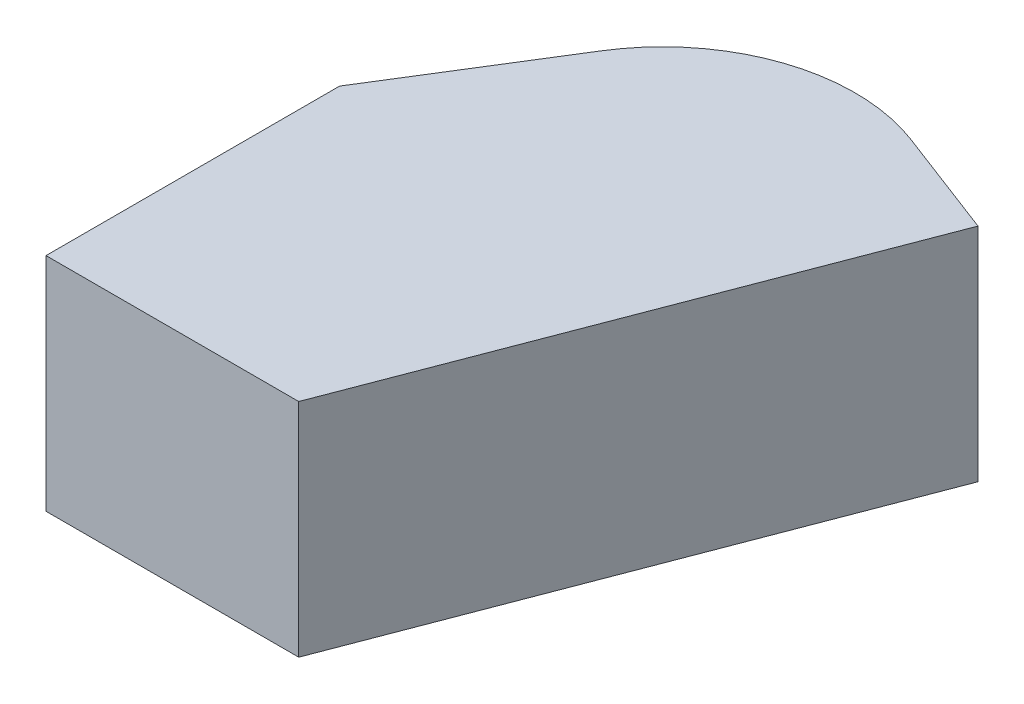
from build123d import *

# Parameters (mm, degrees)
BOSS_EXTRUDE1_DEPTH = 58.42


with BuildPart() as part:
    # Sketch1 → Boss-Extrude1 (new body)
    with BuildSketch(Plane(origin=(0, 0, 0), x_dir=(1, 0, 0), z_dir=(0, 1, 0))):
        with BuildLine():
            Line((-66.673768512, 0), (-40.275724105, 42.472101149))
            ThreePointArc((-40.275724105, 42.472101149), (-13.350388976, 63.796602097), (20.98970616, 63.114049105))
            Line((20.98970616, 63.114049105), (49.511648498, 52.224068087))
            Line((49.511648498, 52.224068087), (0, -77.45185891))
            Line((0, -77.45185891), (-66.673768512, -77.45185891))
            Line((-66.673768512, -77.45185891), (-66.673768512, 0))
        make_face()
    extrude(amount=BOSS_EXTRUDE1_DEPTH)


solid = part.part
